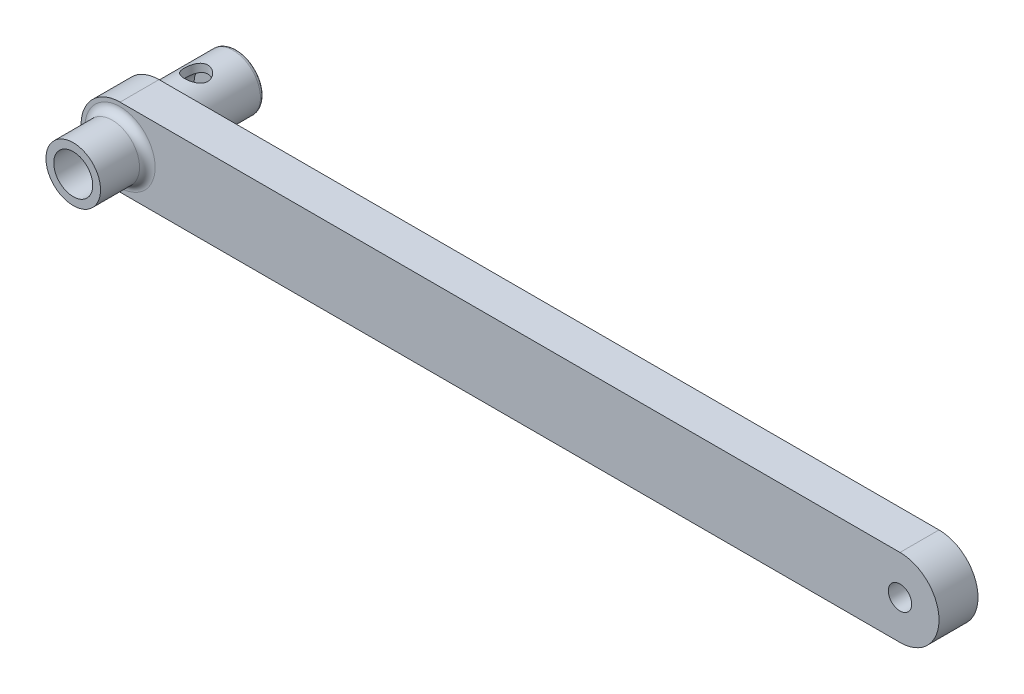
from build123d import *

# Parameters (mm, degrees)
ESQUISSE1_R                  = 2.5
ESQUISSE1_R_2                = 1.5
BOSS_EXTRU_1_DEPTH           = 5
BOSS_EXTRU_2_START           = -15
ESQUISSE2_R                  = 3.5
ESQUISSE2_R_2                = 2.5
BOSS_EXTRU_2_DEPTH           = 10
ESQUISSE3_R                  = 3.5
BOSS_EXTRU_3_DEPTH           = 3
CONG_1_R                     = 0.5
ENL_V_MAT_EXTRU_1_DEPTH      = 57.124860802
ENL_V_MAT_EXTRU_1_DEPTH_BACK = 57.124860802
ESQUISSE4_R                  = 1.5
ESQUISSE5_R                  = 3.5
ESQUISSE5_R_2                = 2.5
BOSS_EXTRU_4_DEPTH           = 6
CONG_2_R                     = 1
CONG_3_R                     = 1


with BuildPart() as part:
    # Esquisse1 → Boss.-Extru.1 (new body)
    with BuildSketch(Plane.XY):
        with BuildLine():
            Line((-50, 5), (50, 5))
            ThreePointArc((50, 5), (55, 0), (50, -5))
            Line((50, -5), (-50, -5))
            ThreePointArc((-50, -5), (-55, 0), (-50, 5))
        make_face()
        with Locations((-50, 0)):
            Circle(ESQUISSE1_R, mode=Mode.SUBTRACT)
        with Locations((50, 0)):
            Circle(ESQUISSE1_R_2, mode=Mode.SUBTRACT)
    extrude(amount=BOSS_EXTRU_1_DEPTH)

    # Esquisse2 → Boss.-Extru.2 (add)
    with BuildSketch(Plane.XY.offset(5).offset(BOSS_EXTRU_2_START)):
        with Locations((-50, 0)):
            Circle(ESQUISSE2_R)
        with Locations((-50, 0)):
            Circle(ESQUISSE2_R_2, mode=Mode.SUBTRACT)
    extrude(amount=BOSS_EXTRU_2_DEPTH)

    # Esquisse3 → Boss.-Extru.3 (add)
    with BuildSketch(Plane(origin=(0, 0, -10), x_dir=(-1, 0, 0), z_dir=(0, 0, -1))):
        with Locations(Location((50, 0, 0), (0, 0, 180))):
            Circle(ESQUISSE3_R)
    extrude(amount=-BOSS_EXTRU_3_DEPTH)

    # Congé1
    cong_1_edges = [part.edges().sort_by_distance(p)[0] for p in [
        (-53.5, 0, -10),
    ]]
    fillet(cong_1_edges, radius=CONG_1_R)

    # Esquisse4 → Enlèv. mat.-Extru.1 (cut, two sides: drawn at the far end of the back side and taken through both)
    with BuildSketch(Plane(origin=(0, 0, 0), x_dir=(1, 0, 0), z_dir=(0, 1, 0)).offset(-ENL_V_MAT_EXTRU_1_DEPTH_BACK)):
        with Locations(Location((-50, 4.75, 0), (0, 0, 270))):
            Circle(ESQUISSE4_R)
    extrude(amount=ENL_V_MAT_EXTRU_1_DEPTH + ENL_V_MAT_EXTRU_1_DEPTH_BACK, mode=Mode.SUBTRACT)

    # Esquisse5 → Boss.-Extru.4 (add)
    with BuildSketch(Plane.XY.offset(5)):
        with Locations((-50, 0)):
            Circle(ESQUISSE5_R)
        with Locations(Location((-50, 0, 0), (0, 0, 180))):
            Circle(ESQUISSE5_R_2, mode=Mode.SUBTRACT)
    extrude(amount=BOSS_EXTRU_4_DEPTH)

    # Congé2
    cong_2_edges = [part.edges().sort_by_distance(p)[0] for p in [
        (-53.5, 0, 5),
    ]]
    fillet(cong_2_edges, radius=CONG_2_R)

    # Congé3
    cong_3_edges = [part.edges().sort_by_distance(p)[0] for p in [
        (-53.5, 0, 0),
    ]]
    fillet(cong_3_edges, radius=CONG_3_R)


solid = part.part
